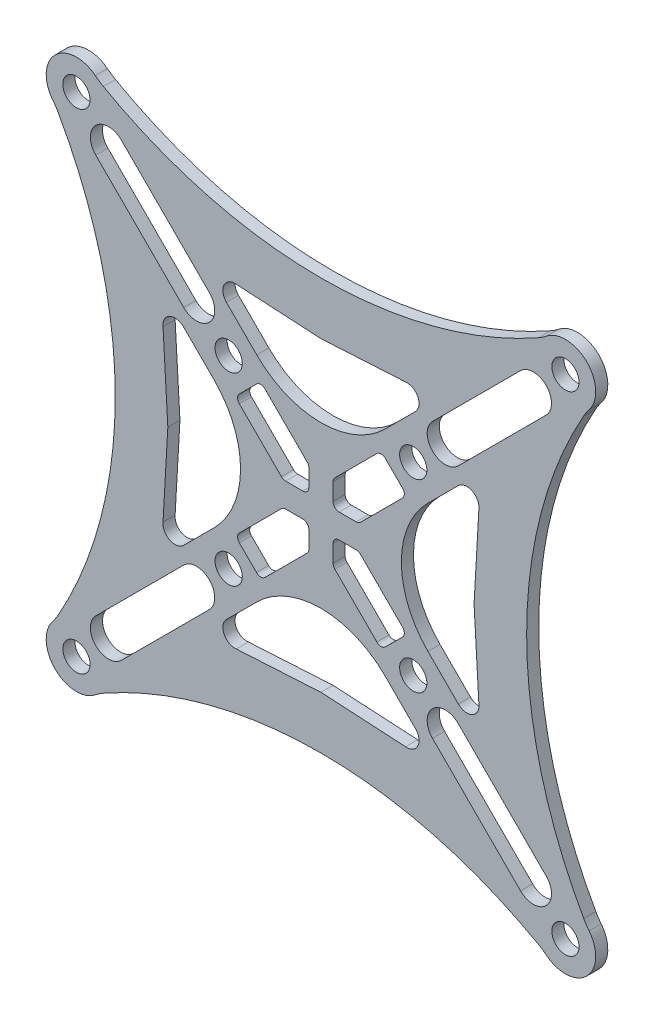
from build123d import *

# Parameters (mm, degrees)
SKETCH_1_R      = 2.25
EXTRUDE_1_DEPTH = 2


with BuildPart() as part:
    # 草图1 → 凸台-拉伸1 (new body)
    with BuildSketch(Plane.XY):
        with BuildLine():
            ThreePointArc((-28.989743456, -12.703084611), (-28.615471369, -19.355253569), (-21.963302457, -19.729526473))
            ThreePointArc((-21.963302457, -19.729526473), (-21.317440963, -19.255716306), (-20.635728807, -18.835119492))
            ThreePointArc((-20.635728807, -18.835119492), (15.320295878, -9.409602941), (51.276319666, -18.835122912))
            ThreePointArc((51.276319666, -18.835122912), (51.958030077, -19.255718643), (52.603890016, -19.729527457))
            ThreePointArc((52.603890016, -19.729527457), (59.256058252, -19.35525301), (59.63032978, -12.703084611))
            ThreePointArc((59.63032978, -12.703084611), (59.156519156, -12.057222615), (58.735921973, -11.375509894))
            ThreePointArc((58.735921973, -11.375509894), (49.31040586, 24.580510531), (58.735921977, 60.536530955))
            ThreePointArc((58.735921977, 60.536530955), (59.156519159, 61.218243674), (59.630329781, 61.864105668))
            ThreePointArc((59.630329781, 61.864105668), (59.256057258, 68.516275059), (52.603887821, 68.890546763))
            ThreePointArc((52.603887821, 68.890546763), (51.958025325, 68.416735684), (51.27631204, 67.996138133))
            ThreePointArc((51.27631204, 67.996138133), (15.320295874, 58.570622456), (-20.635721187, 67.996134716))
            ThreePointArc((-20.635721187, 67.996134716), (-21.317436214, 68.41673335), (-21.963300263, 68.89054578))
            ThreePointArc((-21.963300263, 68.89054578), (-28.615470377, 68.516275617), (-28.989743456, 61.864105667))
            ThreePointArc((-28.989743456, 61.864105667), (-28.515932834, 61.218243673), (-28.095335651, 60.536530953))
            ThreePointArc((-28.095335651, 60.536530953), (-18.669819536, 24.580510528), (-28.095335651, -11.375509897))
            ThreePointArc((-28.095335651, -11.375509897), (-28.515932834, -12.057222617), (-28.989743456, -12.703084611))
        make_face()
        with Locations((-25.079937246, -15.81971988)):
            Circle(SKETCH_1_R, mode=Mode.SUBTRACT)
        with Locations((0.070293162, 9.330510528)):
            Circle(SKETCH_1_R, mode=Mode.SUBTRACT)
        with Locations((30.570293162, 9.330510528)):
            Circle(SKETCH_1_R, mode=Mode.SUBTRACT)
        with Locations((55.72052357, -15.81971988)):
            Circle(SKETCH_1_R, mode=Mode.SUBTRACT)
        with Locations((55.72052357, 64.980740936)):
            Circle(SKETCH_1_R, mode=Mode.SUBTRACT)
        with Locations((30.570293162, 39.830510528)):
            Circle(SKETCH_1_R, mode=Mode.SUBTRACT)
        with Locations((0.070293162, 39.830510528)):
            Circle(SKETCH_1_R, mode=Mode.SUBTRACT)
        with Locations((-25.079937246, 64.980740936)):
            Circle(SKETCH_1_R, mode=Mode.SUBTRACT)
        with BuildLine():
            Line((-2.357376368, 13.97390881), (-7.376184091, 8.955101087))
            ThreePointArc((-7.376184091, 8.955101087), (-9.660932383, 8.568712171), (-10.777124659, 10.599349006))
            add(Edge.make_bspline(
                [(-10.777124659, 10.599349006), (-10.511380202, 15.25973618), (-10.245635746, 19.920123354), (-9.979891289, 24.580510528)],
                knots=[0, 0, 0, 0, 1.400387298, 1.400387298, 1.400387298, 1.400387298], degree=3))
            add(Edge.make_bspline(
                [(-10.777124659, 38.56167205), (-10.511380202, 33.901284876), (-10.245635746, 29.240897702), (-9.979891289, 24.580510528)],
                knots=[0, 0, 0, 0, 1.400387298, 1.400387298, 1.400387298, 1.400387298], degree=3))
            ThreePointArc((-10.777124659, 38.56167205), (-9.660932383, 40.592308885), (-7.376184091, 40.205919969))
            Line((-7.376184091, 40.205919969), (-2.357376368, 35.187112246))
            ThreePointArc((-2.357376368, 35.187112246), (0.894214902, 30.320762013), (2.036021915, 24.580510528))
            ThreePointArc((2.036021915, 24.580510528), (0.894214902, 18.840259042), (-2.357376368, 13.97390881))
        make_face(mode=Mode.SUBTRACT)
        with BuildLine():
            Line((4.66648724, 38.062743575), (3.252273677, 36.648530013))
            Line((3.252273677, 36.648530013), (1.838060115, 35.23431645))
            ThreePointArc((1.838060115, 35.23431645), (1.545166896, 34.527209669), (1.838060115, 33.820102888))
            Line((1.838060115, 33.820102888), (2.191613506, 33.466549497))
            Line((2.191613506, 33.466549497), (4.999207506, 30.658955496))
            Line((4.999207506, 30.658955496), (8.784759256, 26.873403747))
            ThreePointArc((8.784759256, 26.873403747), (9.109182605, 26.656630995), (9.491866037, 26.580510528))
            Line((9.491866037, 26.580510528), (12.320293162, 26.580510528))
            ThreePointArc((12.320293162, 26.580510528), (13.027399943, 26.873403747), (13.320293162, 27.580510528))
            Line((13.320293162, 27.580510528), (13.320293162, 30.408937653))
            ThreePointArc((13.320293162, 30.408937653), (13.244172695, 30.791621085), (13.027399943, 31.116044434))
            Line((13.027399943, 31.116044434), (9.241848194, 34.901596184))
            Line((9.241848194, 34.901596184), (6.434254193, 37.709190184))
            Line((6.434254193, 37.709190184), (6.080700802, 38.062743575))
            ThreePointArc((6.080700802, 38.062743575), (5.373594021, 38.355636794), (4.66648724, 38.062743575))
        make_face(mode=Mode.SUBTRACT)
        with BuildLine():
            Line((4.66648724, 11.098277481), (3.252273677, 12.512491043))
            Line((3.252273677, 12.512491043), (1.838060115, 13.926704606))
            ThreePointArc((1.838060115, 13.926704606), (1.545166896, 14.633811387), (1.838060115, 15.340918168))
            Line((1.838060115, 15.340918168), (2.191613506, 15.694471559))
            Line((2.191613506, 15.694471559), (4.999207506, 18.502065559))
            Line((4.999207506, 18.502065559), (8.784759256, 22.287617309))
            ThreePointArc((8.784759256, 22.287617309), (9.109182605, 22.50439006), (9.491866037, 22.580510528))
            Line((9.491866037, 22.580510528), (12.320293162, 22.580510528))
            ThreePointArc((12.320293162, 22.580510528), (13.027399943, 22.287617309), (13.320293162, 21.580510528))
            Line((13.320293162, 21.580510528), (13.320293162, 18.752083403))
            ThreePointArc((13.320293162, 18.752083403), (13.244172695, 18.369399971), (13.027399943, 18.044976622))
            Line((13.027399943, 18.044976622), (9.241848194, 14.259424872))
            Line((9.241848194, 14.259424872), (6.434254193, 11.451830871))
            Line((6.434254193, 11.451830871), (6.080700802, 11.098277481))
            ThreePointArc((6.080700802, 11.098277481), (5.373594021, 10.805384262), (4.66648724, 11.098277481))
        make_face(mode=Mode.SUBTRACT)
        with BuildLine():
            Line((-3.111687353, 1.905889325), (-17.655316043, -12.637739365))
            ThreePointArc((-17.655316043, -12.637739365), (-21.897956731, -12.637739365), (-21.897956731, -8.395098678))
            Line((-21.897956731, -8.395098678), (-7.35432804, 6.148530013))
            ThreePointArc((-7.35432804, 6.148530013), (-3.111687353, 6.148530013), (-3.111687353, 1.905889325))
        make_face(mode=Mode.SUBTRACT)
        with BuildLine():
            Line((-0.305116279, 1.884033275), (4.713691444, 6.902840998))
            ThreePointArc((4.713691444, 6.902840998), (9.580041677, 10.154432268), (15.320293162, 11.29623928))
            ThreePointArc((15.320293162, 11.29623928), (21.060544648, 10.154432268), (25.92689488, 6.902840998))
            Line((25.92689488, 6.902840998), (30.945702603, 1.884033275))
            ThreePointArc((30.945702603, 1.884033275), (31.332091519, -0.400715017), (29.301454684, -1.516907293))
            add(Edge.make_bspline(
                [(29.301454684, -1.516907293), (24.64106751, -1.251162837), (19.980680336, -0.98541838), (15.320293162, -0.719673923)],
                knots=[0, 0, 0, 0, 1.400387298, 1.400387298, 1.400387298, 1.400387298], degree=3))
            add(Edge.make_bspline(
                [(1.33913164, -1.516907293), (5.999518814, -1.251162837), (10.659905988, -0.98541838), (15.320293162, -0.719673923)],
                knots=[0, 0, 0, 0, 1.400387298, 1.400387298, 1.400387298, 1.400387298], degree=3))
            ThreePointArc((1.33913164, -1.516907293), (-0.691505195, -0.400715017), (-0.305116279, 1.884033275))
        make_face(mode=Mode.SUBTRACT)
        with BuildLine():
            Line((52.538543055, 57.556119733), (37.994914365, 43.012491043))
            ThreePointArc((37.994914365, 43.012491043), (33.752273677, 43.012491043), (33.752273677, 47.25513173))
            Line((33.752273677, 47.25513173), (48.295902368, 61.798760421))
            ThreePointArc((48.295902368, 61.798760421), (52.538543055, 61.798760421), (52.538543055, 57.556119733))
        make_face(mode=Mode.SUBTRACT)
        with BuildLine():
            Line((25.974099084, 11.098277481), (27.388312647, 12.512491043))
            Line((27.388312647, 12.512491043), (28.802526209, 13.926704606))
            ThreePointArc((28.802526209, 13.926704606), (29.095419428, 14.633811387), (28.802526209, 15.340918168))
            Line((28.802526209, 15.340918168), (28.448972818, 15.694471559))
            Line((28.448972818, 15.694471559), (25.641378818, 18.502065559))
            Line((25.641378818, 18.502065559), (21.855827068, 22.287617309))
            ThreePointArc((21.855827068, 22.287617309), (21.531403719, 22.50439006), (21.148720287, 22.580510528))
            Line((21.148720287, 22.580510528), (18.320293162, 22.580510528))
            ThreePointArc((18.320293162, 22.580510528), (17.613186381, 22.287617309), (17.320293162, 21.580510528))
            Line((17.320293162, 21.580510528), (17.320293162, 18.752083403))
            ThreePointArc((17.320293162, 18.752083403), (17.39641363, 18.369399971), (17.613186381, 18.044976622))
            Line((17.613186381, 18.044976622), (21.398738131, 14.259424872))
            Line((21.398738131, 14.259424872), (24.206332131, 11.451830871))
            Line((24.206332131, 11.451830871), (24.559885522, 11.098277481))
            ThreePointArc((24.559885522, 11.098277481), (25.266992303, 10.805384262), (25.974099084, 11.098277481))
        make_face(mode=Mode.SUBTRACT)
        with BuildLine():
            Line((37.994914365, 6.148530013), (52.538543055, -8.395098678))
            ThreePointArc((52.538543055, -8.395098678), (52.538543055, -12.637739365), (48.295902368, -12.637739365))
            Line((48.295902368, -12.637739365), (33.752273677, 1.905889325))
            ThreePointArc((33.752273677, 1.905889325), (33.752273677, 6.148530013), (37.994914365, 6.148530013))
        make_face(mode=Mode.SUBTRACT)
        with BuildLine():
            Line((32.997962692, 13.97390881), (38.016770415, 8.955101087))
            ThreePointArc((38.016770415, 8.955101087), (40.301518707, 8.568712171), (41.417710983, 10.599349006))
            add(Edge.make_bspline(
                [(41.417710983, 10.599349006), (41.151966527, 15.25973618), (40.88622207, 19.920123354), (40.620477613, 24.580510528)],
                knots=[0, 0, 0, 0, 1.400387298, 1.400387298, 1.400387298, 1.400387298], degree=3))
            add(Edge.make_bspline(
                [(41.417710983, 38.56167205), (41.151966527, 33.901284876), (40.88622207, 29.240897702), (40.620477613, 24.580510528)],
                knots=[0, 0, 0, 0, 1.400387298, 1.400387298, 1.400387298, 1.400387298], degree=3))
            ThreePointArc((41.417710983, 38.56167205), (40.301518707, 40.592308885), (38.016770415, 40.205919969))
            Line((38.016770415, 40.205919969), (32.997962692, 35.187112246))
            ThreePointArc((32.997962692, 35.187112246), (29.746371422, 30.320762013), (28.604564409, 24.580510528))
            ThreePointArc((28.604564409, 24.580510528), (29.746371422, 18.840259042), (32.997962692, 13.97390881))
        make_face(mode=Mode.SUBTRACT)
        with BuildLine():
            Line((21.398738131, 34.901596184), (24.206332131, 37.709190184))
            Line((24.206332131, 37.709190184), (24.559885522, 38.062743575))
            ThreePointArc((24.559885522, 38.062743575), (25.266992303, 38.355636794), (25.974099084, 38.062743575))
            Line((25.974099084, 38.062743575), (27.388312647, 36.648530013))
            Line((27.388312647, 36.648530013), (28.802526209, 35.23431645))
            ThreePointArc((28.802526209, 35.23431645), (29.095419428, 34.527209669), (28.802526209, 33.820102888))
            Line((28.802526209, 33.820102888), (28.448972818, 33.466549497))
            Line((28.448972818, 33.466549497), (25.641378818, 30.658955496))
            Line((25.641378818, 30.658955496), (21.855827068, 26.873403747))
            ThreePointArc((21.855827068, 26.873403747), (21.531403719, 26.656630995), (21.148720287, 26.580510528))
            Line((21.148720287, 26.580510528), (18.320293162, 26.580510528))
            ThreePointArc((18.320293162, 26.580510528), (17.613186381, 26.873403747), (17.320293162, 27.580510528))
            Line((17.320293162, 27.580510528), (17.320293162, 30.408937653))
            ThreePointArc((17.320293162, 30.408937653), (17.39641363, 30.791621085), (17.613186381, 31.116044434))
            Line((17.613186381, 31.116044434), (21.398738131, 34.901596184))
        make_face(mode=Mode.SUBTRACT)
        with BuildLine():
            Line((-0.305116279, 47.276987781), (4.713691444, 42.258180058))
            ThreePointArc((4.713691444, 42.258180058), (9.580041677, 39.006588788), (15.320293162, 37.864781775))
            ThreePointArc((15.320293162, 37.864781775), (21.060544648, 39.006588788), (25.92689488, 42.258180058))
            Line((25.92689488, 42.258180058), (30.945702603, 47.276987781))
            ThreePointArc((30.945702603, 47.276987781), (31.332091519, 49.561736073), (29.301454684, 50.677928349))
            add(Edge.make_bspline(
                [(29.301454684, 50.677928349), (24.64106751, 50.412183892), (19.980680336, 50.146439436), (15.320293162, 49.880694979)],
                knots=[0, 0, 0, 0, 1.400387298, 1.400387298, 1.400387298, 1.400387298], degree=3))
            add(Edge.make_bspline(
                [(1.33913164, 50.677928349), (5.999518814, 50.412183892), (10.659905988, 50.146439436), (15.320293162, 49.880694979)],
                knots=[0, 0, 0, 0, 1.400387298, 1.400387298, 1.400387298, 1.400387298], degree=3))
            ThreePointArc((1.33913164, 50.677928349), (-0.691505195, 49.561736073), (-0.305116279, 47.276987781))
        make_face(mode=Mode.SUBTRACT)
        with BuildLine():
            Line((-7.35432804, 43.012491043), (-21.897956731, 57.556119733))
            ThreePointArc((-21.897956731, 57.556119733), (-21.897956731, 61.798760421), (-17.655316043, 61.798760421))
            Line((-17.655316043, 61.798760421), (-3.111687353, 47.25513173))
            ThreePointArc((-3.111687353, 47.25513173), (-3.111687353, 43.012491043), (-7.35432804, 43.012491043))
        make_face(mode=Mode.SUBTRACT)
    extrude(amount=EXTRUDE_1_DEPTH)


solid = part.part
